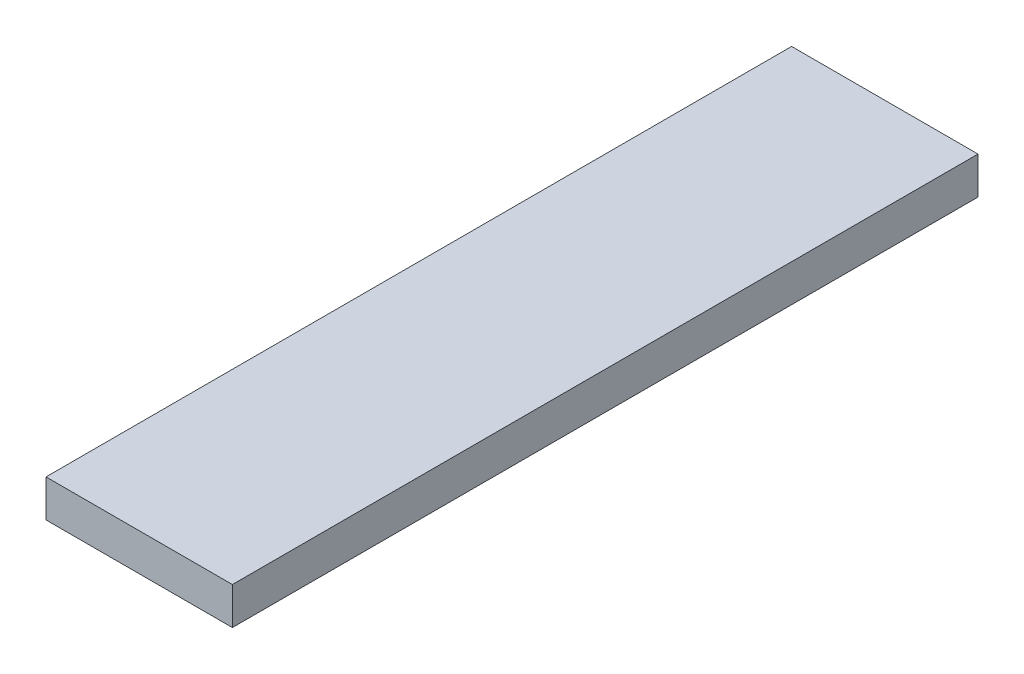
from build123d import *

# Parameters (mm, degrees)
SKETCH1_W           = 10
SKETCH1_H           = 40
BOSS_EXTRUDE1_DEPTH = 2


with BuildPart() as part:
    # Sketch1 → Boss-Extrude1 (new body)
    with BuildSketch(Plane(origin=(0, 0, 0), x_dir=(1, 0, 0), z_dir=(0, 1, 0))):
        Rectangle(SKETCH1_W, SKETCH1_H)
    extrude(amount=BOSS_EXTRUDE1_DEPTH)


solid = part.part
